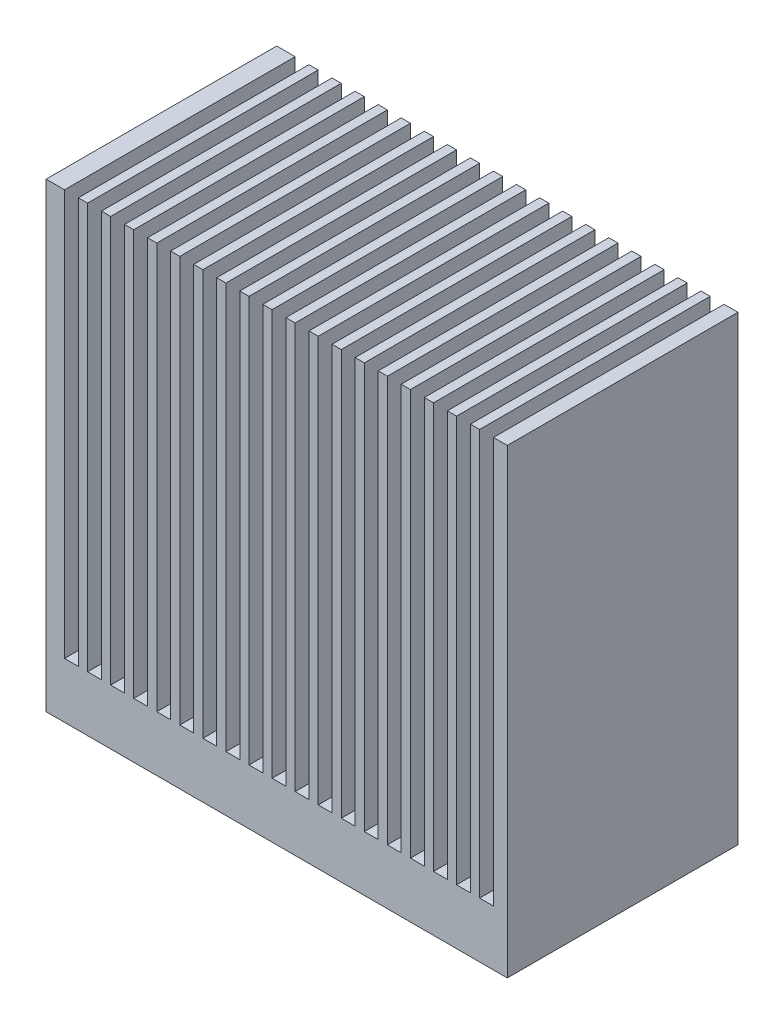
from build123d import *

# Parameters (mm, degrees)
SKETCH_1_W          = 50
SKETCH_1_H          = 25
EXTRUDE_1_DEPTH     = 50
SKETCH_2_W          = 1.5
SKETCH_2_H          = 25
CUT_EXTRUDE_1_DEPTH = 44


with BuildPart() as part:
    # 草图1 → 拉伸1 (new body)
    with BuildSketch(Plane(origin=(0, 0, 0), x_dir=(1, 0, 0), z_dir=(0, 1, 0))):
        Rectangle(SKETCH_1_W, SKETCH_1_H)
    extrude(amount=EXTRUDE_1_DEPTH)

    # 草图2 → 切除-拉伸1 (cut)
    with BuildSketch(Plane(origin=(0, 50, 0), x_dir=(-1, 0, 0), z_dir=(0, 1, 0))):
        with Locations((-0.25, 0)):
            Rectangle(SKETCH_2_W, SKETCH_2_H)
        with Locations((2.25, 0)):
            Rectangle(SKETCH_2_W, SKETCH_2_H)
        with Locations((4.75, 0)):
            Rectangle(SKETCH_2_W, SKETCH_2_H)
        with Locations((7.25, 0)):
            Rectangle(SKETCH_2_W, SKETCH_2_H)
        with Locations((9.75, 0)):
            Rectangle(SKETCH_2_W, SKETCH_2_H)
        with Locations((12.25, 0)):
            Rectangle(SKETCH_2_W, SKETCH_2_H)
        with Locations((14.75, 0)):
            Rectangle(SKETCH_2_W, SKETCH_2_H)
        with Locations((17.25, 0)):
            Rectangle(SKETCH_2_W, SKETCH_2_H)
        with Locations((19.75, 0)):
            Rectangle(SKETCH_2_W, SKETCH_2_H)
        with Locations((22.25, 0)):
            Rectangle(SKETCH_2_W, SKETCH_2_H)
        with Locations((-2.75, 0)):
            Rectangle(SKETCH_2_W, SKETCH_2_H)
        with Locations((-5.25, 0)):
            Rectangle(SKETCH_2_W, SKETCH_2_H)
        with Locations((-7.75, 0)):
            Rectangle(SKETCH_2_W, SKETCH_2_H)
        with Locations((-10.25, 0)):
            Rectangle(SKETCH_2_W, SKETCH_2_H)
        with Locations((-12.75, 0)):
            Rectangle(SKETCH_2_W, SKETCH_2_H)
        with Locations((-15.25, 0)):
            Rectangle(SKETCH_2_W, SKETCH_2_H)
        with Locations((-17.75, 0)):
            Rectangle(SKETCH_2_W, SKETCH_2_H)
        with Locations((-20.25, 0)):
            Rectangle(SKETCH_2_W, SKETCH_2_H)
        with Locations((-22.75, 0)):
            Rectangle(SKETCH_2_W, SKETCH_2_H)
    extrude(amount=-CUT_EXTRUDE_1_DEPTH, mode=Mode.SUBTRACT)


solid = part.part
